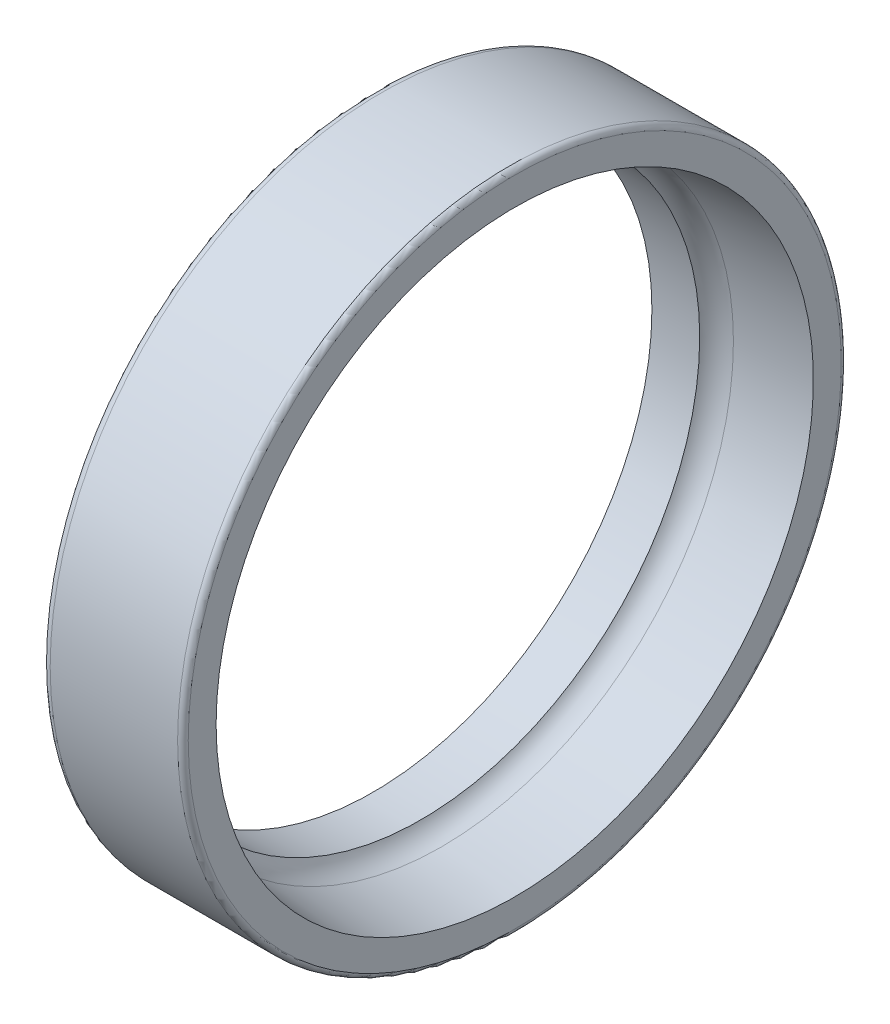
from build123d import *


with BuildPart() as part:
    # Sketch1 → Revolve1 (revolve)
    with BuildSketch(Plane.XY, mode=Mode.PRIVATE) as revolve1_sk:
        with BuildLine():
            Line((0, 31.5), (5.401923789, 31.5))
            ThreePointArc((5.401923789, 31.5), (6.382242149, 32.526432175), (7.724684297, 32.987340165))
            Line((7.724684297, 32.987340165), (16, 33.75))
            Line((16, 33.75), (16, 36.9))
            ThreePointArc((16, 36.9), (15.824264069, 37.324264069), (15.4, 37.5))
            Line((15.4, 37.5), (1, 37.5))
            ThreePointArc((1, 37.5), (0.292893219, 37.207106781), (0, 36.5))
            Line((0, 36.5), (0, 31.5))
        make_face()
    revolve(revolve1_sk.sketch.rotate(Axis((16, 0, 0), (-1, 0, 0)), 270), axis=Axis((16, 0, 0), (-1, 0, 0)))


solid = part.part
